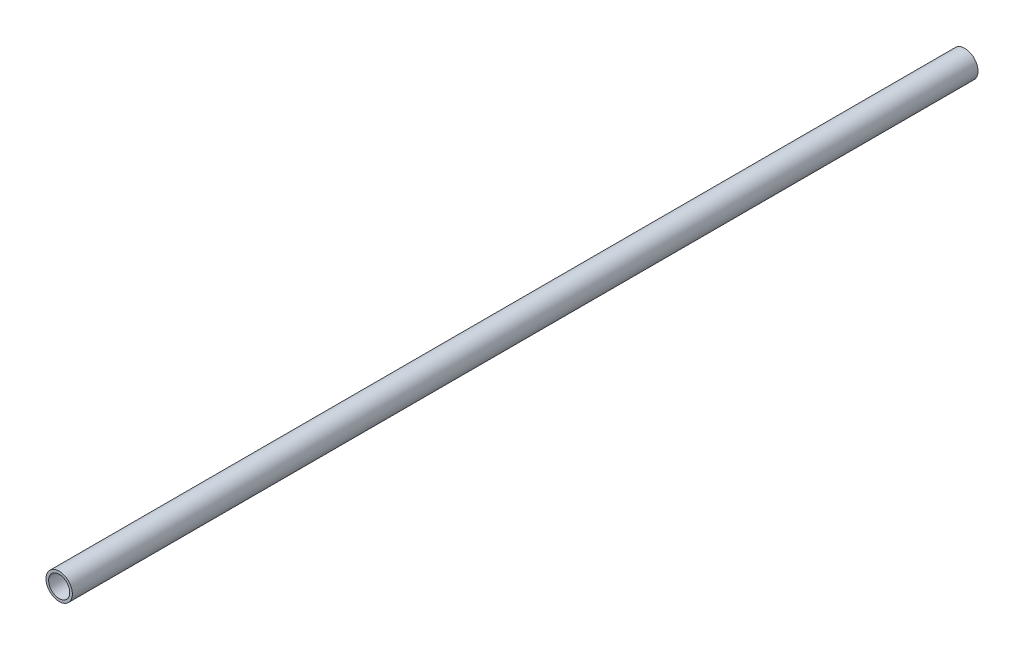
from build123d import *

# Parameters (mm, degrees)
SKETCH1_R           = 5
SKETCH1_R_2         = 4
EXTRUDE_THIN1_DEPTH = 343


with BuildPart() as part:
    # Sketch1 → Extrude-Thin1 (new body)
    with BuildSketch(Plane.XY):
        Circle(SKETCH1_R)
        Circle(SKETCH1_R_2, mode=Mode.SUBTRACT)
    extrude(amount=EXTRUDE_THIN1_DEPTH)


solid = part.part
